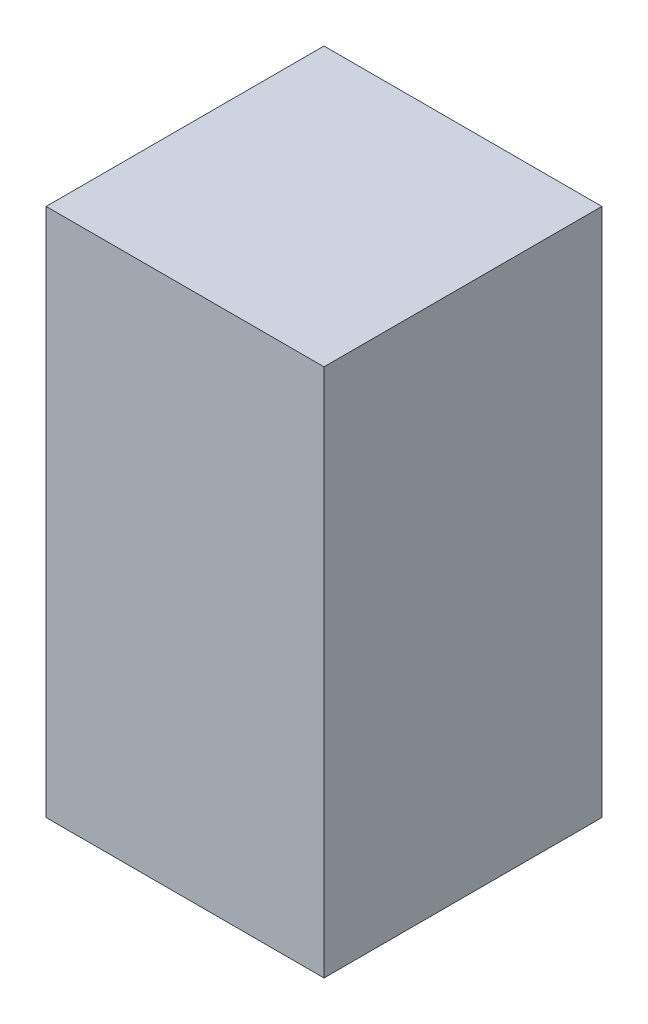
from build123d import *

# Parameters (mm, degrees)
BOSS_EXTRUDE1_DEPTH = 304.8


with BuildPart() as part:
    # Sketch1 → Boss-Extrude1 (new body)
    with BuildSketch(Plane(origin=(0, 0, 0), x_dir=(1, 0, 0), z_dir=(0, 1, 0))):
        Polygon((0, 80), (-80, 80), (-80, 0), (-80, -80), (0, -80), (80, -80), (80, 0), (80, 80), align=None)
    extrude(amount=BOSS_EXTRUDE1_DEPTH)


solid = part.part
